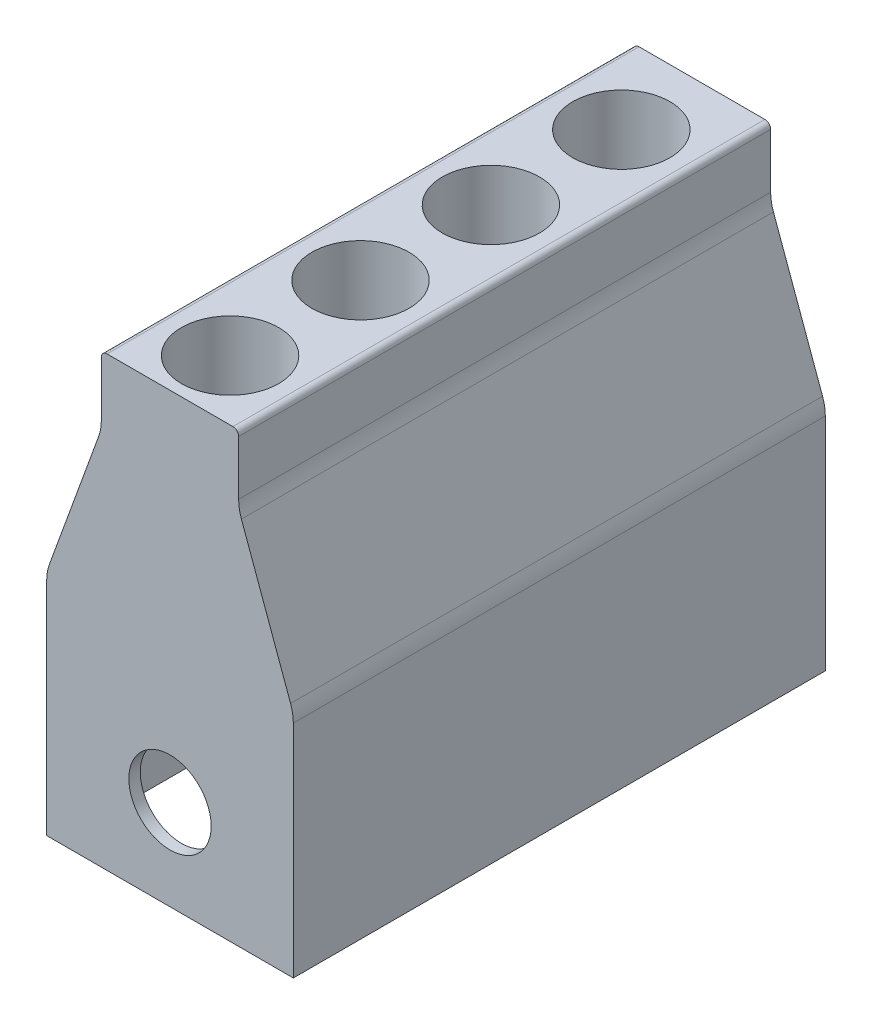
from build123d import *

# Parameters (mm, degrees)
BOSS_EXTRUDE1_DEPTH  = 465
SHELL1_T             = -10
SKETCH3_R            = 36
CUT_EXTRUDE2_DEPTH   = 570
SKETCH2_R            = 42.5
CUT_EXTRUDE3_DEPTH   = 10
SKETCH6_R            = 45.5
SKETCH6_R_2          = 42.5
BOSS_EXTRUDE14_DEPTH = 120


with BuildPart() as part:
    # Sketch1 → Boss-Extrude1 (new body)
    with BuildSketch(Plane.XY):
        with BuildLine():
            Line((107.802304208, 0), (-107.802304208, 0))
            Line((-107.802304208, 0), (-107.802304208, 192.946920772))
            ThreePointArc((-107.802304208, 192.946920772), (-107.194614328, 199.892847878), (-105.390009039, 206.627726505))
            Line((-105.390009039, 206.627726505), (-62.412295169, 324.708024904))
            ThreePointArc((-62.412295169, 324.708024904), (-60.60768988, 331.442903531), (-60, 338.388830637))
            Line((-60, 338.388830637), (-60, 386))
            ThreePointArc((-60, 386), (-58.535533906, 389.535533906), (-55, 391))
            Line((-55, 391), (55, 391))
            ThreePointArc((55, 391), (58.535533906, 389.535533906), (60, 386))
            Line((60, 386), (60, 338.388830637))
            ThreePointArc((60, 338.388830637), (60.60768988, 331.442903531), (62.412295169, 324.708024904))
            Line((62.412295169, 324.708024904), (105.390009039, 206.627726505))
            ThreePointArc((105.390009039, 206.627726505), (107.194614328, 199.892847878), (107.802304208, 192.946920772))
            Line((107.802304208, 192.946920772), (107.802304208, 0))
        make_face()
    extrude(amount=BOSS_EXTRUDE1_DEPTH)

    # Shell1
    shell1_openings = [part.faces().sort_by_distance(p)[0] for p in [
        (0, 0, 232.5),
    ]]
    offset(amount=SHELL1_T, openings=shell1_openings, kind=Kind.INTERSECTION)

    # Sketch3 → Cut-Extrude2 (cut)
    with BuildSketch(Plane.XY.offset(465)):
        with Locations(Location((0, 79, 0), (0, 0, 180))):
            Circle(SKETCH3_R)
    extrude(amount=-CUT_EXTRUDE2_DEPTH, mode=Mode.SUBTRACT)

    # Sketch2 → Cut-Extrude3 (cut)
    with BuildSketch(Plane(origin=(0, 391, 0), x_dir=(1, 0, 0), z_dir=(0, 1, 0))):
        with Locations(Location((0, -70.502440314, 0), (0, 0, 270))):
            Circle(SKETCH2_R)
        with Locations(Location((0, -184.502440314, 0), (0, 0, 270))):
            Circle(SKETCH2_R)
        with Locations(Location((0, -298.502440314, 0), (0, 0, 270))):
            Circle(SKETCH2_R)
        with Locations(Location((0, -412.502440314, 0), (0, 0, 270))):
            Circle(SKETCH2_R)
    extrude(amount=-CUT_EXTRUDE3_DEPTH, mode=Mode.SUBTRACT)

    # Sketch6 → Boss-Extrude14 (add)
    # profile 1 of 4: a face of its own
    with BuildSketch(Plane(origin=(0, 391, 0), x_dir=(1, 0, 0), z_dir=(0, 1, 0))):
        with Locations((0, -412.502440314)):
            Circle(SKETCH6_R)
        with Locations(Location((0, -412.502440314, 0), (0, 0, 270))):
            Circle(SKETCH6_R_2, mode=Mode.SUBTRACT)
    # profile 2 of 4: a face of its own
    with BuildSketch(Plane(origin=(0, 391, 0), x_dir=(1, 0, 0), z_dir=(0, 1, 0))):
        with Locations(Location((0, -298.502440314, 0), (0, 0, 270))):
            Circle(SKETCH6_R)
        with Locations(Location((0, -298.502440314, 0), (0, 0, 270))):
            Circle(SKETCH6_R_2, mode=Mode.SUBTRACT)
    # profile 3 of 4: a face of its own
    with BuildSketch(Plane(origin=(0, 391, 0), x_dir=(1, 0, 0), z_dir=(0, 1, 0))):
        with Locations(Location((0, -184.502440314, 0), (0, 0, 270))):
            Circle(SKETCH6_R)
        with Locations(Location((0, -184.502440314, 0), (0, 0, 270))):
            Circle(SKETCH6_R_2, mode=Mode.SUBTRACT)
    # profile 4 of 4: a face of its own
    with BuildSketch(Plane(origin=(0, 391, 0), x_dir=(1, 0, 0), z_dir=(0, 1, 0))):
        with Locations(Location((0, -70.502440314, 0), (0, 0, 270))):
            Circle(SKETCH6_R)
        with Locations(Location((0, -70.502440314, 0), (0, 0, 270))):
            Circle(SKETCH6_R_2, mode=Mode.SUBTRACT)
    extrude(amount=-BOSS_EXTRUDE14_DEPTH)


solid = part.part
